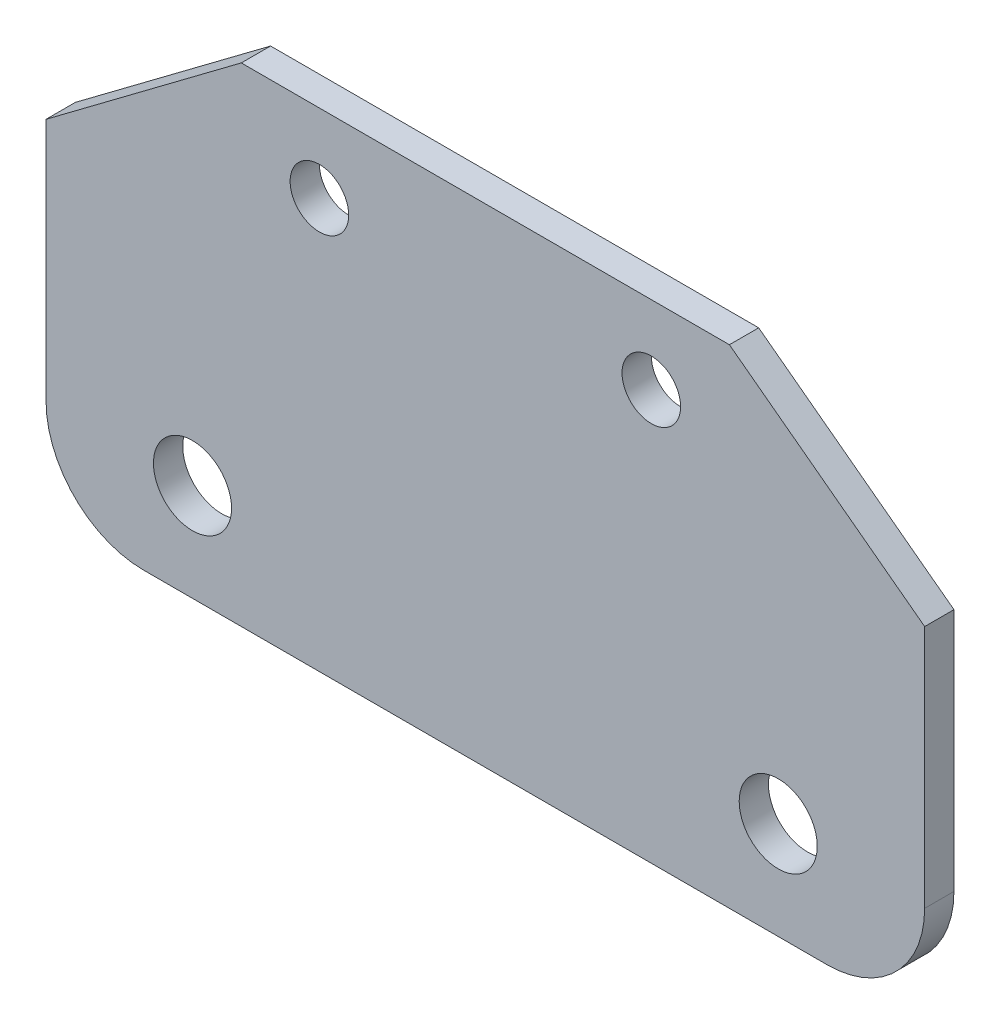
from build123d import *

# Parameters (mm, degrees)
SKETCH1_R           = 3
SKETCH1_R_2         = 4
BOSS_EXTRUDE1_DEPTH = 3
FILLET1_R           = 10


with BuildPart() as part:
    # Sketch1 → Boss-Extrude1 (new body)
    with BuildSketch(Plane.XY):
        Polygon((0, 35), (20, 50), (70, 50), (90, 35), (90, 0), (0, 0), align=None)
        with Locations((28, 42)):
            Circle(SKETCH1_R, mode=Mode.SUBTRACT)
        with Locations((15, 10)):
            Circle(SKETCH1_R_2, mode=Mode.SUBTRACT)
        with Locations(Location((75, 10, 0), (0, 0, 180))):
            Circle(SKETCH1_R_2, mode=Mode.SUBTRACT)
        with Locations(Location((62, 42, 0), (0, 0, 180))):
            Circle(SKETCH1_R, mode=Mode.SUBTRACT)
    extrude(amount=BOSS_EXTRUDE1_DEPTH)

    # Fillet1
    fillet1_edges = [part.edges().sort_by_distance(p)[0] for p in [
        (90, 0, 1.5),
        (0, 0, 1.5),
    ]]
    fillet(fillet1_edges, radius=FILLET1_R)


solid = part.part
